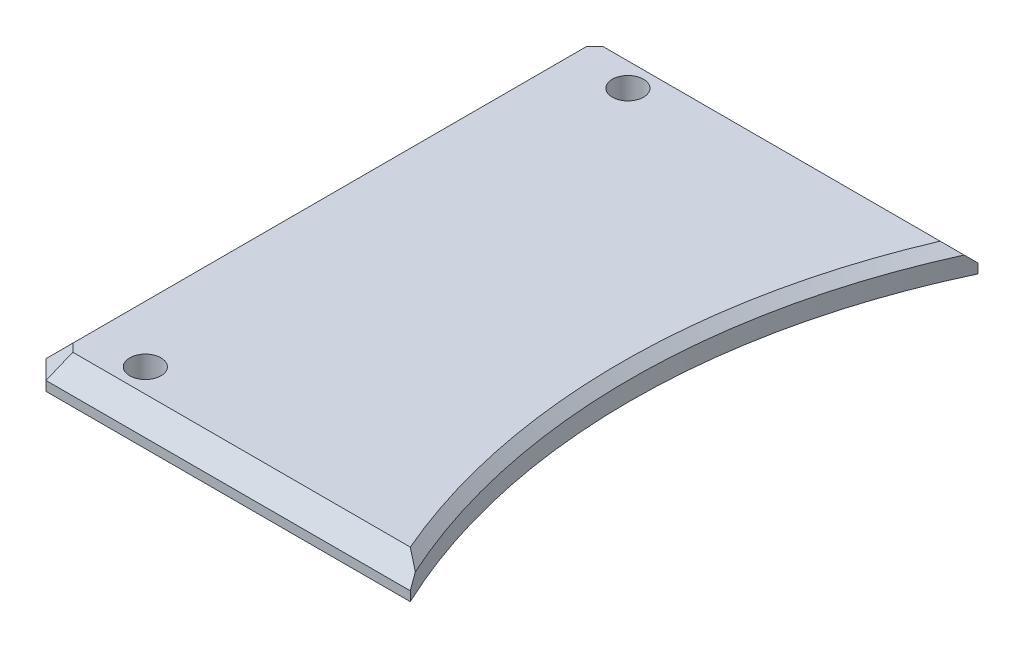
from build123d import *

# Parameters (mm, degrees)
ESQUISSE1_R        = 1.65
BOSS_EXTRU_1_DEPTH = 3
CHANFREIN1_SIZE    = 2
CHANFREIN3_SIZE    = 2
CHANFREIN4_SIZE    = 1


with BuildPart() as part:
    # Esquisse1 → Boss.-Extru.1 (new body)
    with BuildSketch(Plane(origin=(0, 0, 0), x_dir=(1, 0, 0), z_dir=(0, 1, 0))):
        with BuildLine():
            Line((-20.25, -30), (20.25, -30))
            ThreePointArc((20.25, -30), (13.495553203, 0), (20.25, 30))
            Line((20.25, 30), (-20.25, 30))
            Line((-20.25, 30), (-20.25, -30))
        make_face()
        with Locations(Location((-12.25, -25.5, 0), (0, 0, 270))):
            Circle(ESQUISSE1_R, mode=Mode.SUBTRACT)
        with Locations(Location((-12.25, 25.5, 0), (0, 0, 270))):
            Circle(ESQUISSE1_R, mode=Mode.SUBTRACT)
    extrude(amount=-BOSS_EXTRU_1_DEPTH)

    # Chanfrein1
    chanfrein1_edges = [part.edges().sort_by_distance(p)[0] for p in [
        (-20.25, -1.5, 30),
        (-20.25, -1.5, -30),
    ]]
    chamfer(chanfrein1_edges, length=CHANFREIN1_SIZE)

    # Chanfrein3
    chanfrein3_edges = [part.edges().sort_by_distance(p)[0] for p in [
        (-20.25, 0, 0),
        (1, 0, 30),
        (-19.25, 0, -29),
        (-19.25, 0, 29),
        (1, 0, -30),
    ]]
    chamfer(chanfrein3_edges, length=CHANFREIN3_SIZE)

    # Chanfrein4
    chanfrein4_edges = [part.edges().sort_by_distance(p)[0] for p in [
        (13.495553203, 0, 0),
    ]]
    chamfer(chanfrein4_edges, length=CHANFREIN4_SIZE)


solid = part.part
